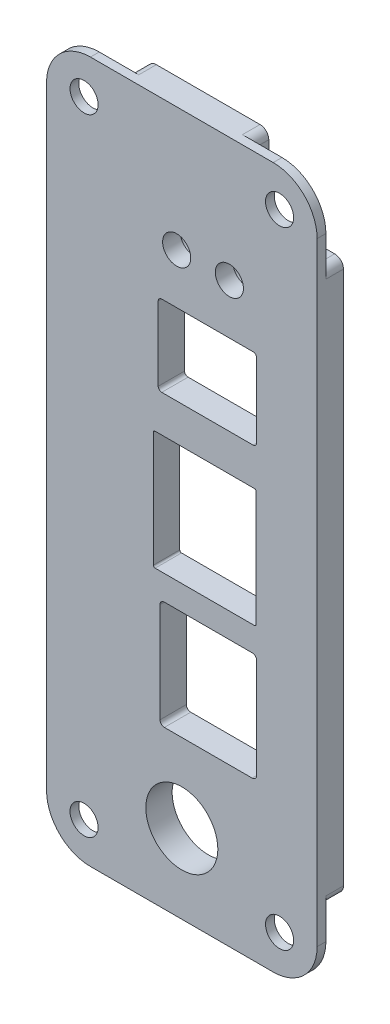
from build123d import *

# Parameters (mm, degrees)
SKETCH_1_R          = 1.6
EXTRUDE_1_DEPTH     = 3
SKETCH_2_W          = 11
SKETCH_2_H          = 38
CUT_EXTRUDE_1_DEPTH = 1
CUT_EXTRUDE_START   = -2
CUT_EXTRUDE_2_DEPTH = 2
SKETCH_4_R          = 1.6
CUT_EXTRUDE_3_DEPTH = 62.990079852
SKETCH_6_R          = 2
CUT_EXTRUDE_4_DEPTH = 1
SKETCH_7_R          = 4.1
CUT_EXTRUDE_5_DEPTH = 63.030395775
FILLET_1_R          = 1


with BuildPart() as part:
    # 草图1 → 凸台-拉伸1 (new body)
    with BuildSketch(Plane.XY):
        with BuildLine():
            Line((47.4, -34.9), (47.4, 34.9))
            ThreePointArc((47.4, 34.9), (45.935533906, 38.435533906), (42.4, 39.9))
            Line((42.4, 39.9), (21.6, 39.9))
            ThreePointArc((21.6, 39.9), (18.064466094, 38.435533906), (16.6, 34.9))
            Line((16.6, 34.9), (16.6, -34.9))
            ThreePointArc((16.6, -34.9), (18.064466094, -38.435533906), (21.6, -39.9))
            Line((21.6, -39.9), (42.4, -39.9))
            ThreePointArc((42.4, -39.9), (45.935533906, -38.435533906), (47.4, -34.9))
        make_face()
        with Locations((37.413843028, 25.79305128)):
            Circle(SKETCH_1_R, mode=Mode.SUBTRACT)
        with Locations((31.413843028, 25.79305128)):
            Circle(SKETCH_1_R, mode=Mode.SUBTRACT)
        with BuildLine():
            Line((40.513850359, -21.477641558), (40.513850359, -10.127641653))
            ThreePointArc((40.513850359, -10.127641653), (40.367403749, -9.774088262), (40.013850359, -9.627641653))
            Line((40.013850359, -9.627641653), (30.013850359, -9.627641653))
            ThreePointArc((30.013850359, -9.627641653), (29.660296968, -9.774088262), (29.513850359, -10.127641653))
            Line((29.513850359, -10.127641653), (29.513850359, -21.477641558))
            ThreePointArc((29.513850359, -21.477641558), (29.660296968, -21.831194949), (30.013850359, -21.977641558))
            Line((30.013850359, -21.977641558), (40.013850359, -21.977641558))
            ThreePointArc((40.013850359, -21.977641558), (40.367403749, -21.831194949), (40.513850359, -21.477641558))
        make_face(mode=Mode.SUBTRACT)
        with BuildLine():
            Line((40.464996896, 6.495389649), (40.464996896, -6.604609867))
            ThreePointArc((40.464996896, -6.604609867), (40.406418252, -6.746031223), (40.264996896, -6.804609867))
            Line((40.264996896, -6.804609867), (28.963873947, -6.804609867))
            ThreePointArc((28.963873947, -6.804609867), (28.822452591, -6.746031223), (28.763873947, -6.604609867))
            Line((28.763873947, -6.604609867), (28.763873947, 6.495389649))
            ThreePointArc((28.763873947, 6.495389649), (28.822452591, 6.636811005), (28.963873947, 6.695389649))
            Line((28.963873947, 6.695389649), (40.264996896, 6.695389649))
            ThreePointArc((40.264996896, 6.695389649), (40.406418252, 6.636811005), (40.464996896, 6.495389649))
        make_face(mode=Mode.SUBTRACT)
        with BuildLine():
            Line((40.513843009, 11.302412116), (40.513843009, 19.702429875))
            ThreePointArc((40.513843009, 19.702429875), (40.396685721, 19.985272588), (40.113843009, 20.102429875))
            Line((40.113843009, 20.102429875), (29.713821303, 20.102429875))
            ThreePointArc((29.713821303, 20.102429875), (29.43097859, 19.985272588), (29.313821303, 19.702429875))
            Line((29.313821303, 19.702429875), (29.313821303, 11.302412116))
            ThreePointArc((29.313821303, 11.302412116), (29.43097859, 11.019569403), (29.713821303, 10.902412116))
            Line((29.713821303, 10.902412116), (40.113843009, 10.902412116))
            ThreePointArc((40.113843009, 10.902412116), (40.396685721, 11.019569403), (40.513843009, 11.302412116))
        make_face(mode=Mode.SUBTRACT)
    extrude(amount=-EXTRUDE_1_DEPTH)

    # 草图2 → 切除-拉伸1 (cut)
    with BuildSketch(Plane(origin=(0, 0, -3), x_dir=(-1, 0, 0), z_dir=(0, 0, -1))):
        with Locations((-22.1, 0)):
            Rectangle(SKETCH_2_W, SKETCH_2_H)
    extrude(amount=-CUT_EXTRUDE_1_DEPTH, mode=Mode.SUBTRACT)

    # 草图3 → 切除-拉伸2 (cut)
    with BuildSketch(Plane(origin=(0, 0, -3), x_dir=(-1, 0, 0), z_dir=(0, 0, -1)).offset(CUT_EXTRUDE_START)):
        with BuildLine():
            Line((-47.4, -31.4), (-38.9, -31.4))
            Line((-38.9, -31.4), (-38.9, -39.9))
            Line((-38.9, -39.9), (-42.4, -39.9))
            ThreePointArc((-42.4, -39.9), (-45.935533906, -38.435533906), (-47.4, -34.9))
            Line((-47.4, -34.9), (-47.4, -31.4))
        make_face()
        with BuildLine():
            Line((-47.4, 34.9), (-47.4, 31.4))
            Line((-47.4, 31.4), (-38.9, 31.4))
            Line((-38.9, 31.4), (-38.9, 39.9))
            Line((-38.9, 39.9), (-42.4, 39.9))
            ThreePointArc((-42.4, 39.9), (-45.935533906, 38.435533906), (-47.4, 34.9))
        make_face()
        with BuildLine():
            Line((-16.6, 31.4), (-25.1, 31.4))
            Line((-25.1, 31.4), (-25.1, 39.9))
            Line((-25.1, 39.9), (-21.6, 39.9))
            ThreePointArc((-21.6, 39.9), (-18.064466094, 38.435533906), (-16.6, 34.9))
            Line((-16.6, 34.9), (-16.6, 31.4))
        make_face()
        with BuildLine():
            Line((-16.6, -34.9), (-16.6, -31.4))
            Line((-16.6, -31.4), (-25.1, -31.4))
            Line((-25.1, -31.4), (-25.1, -39.9))
            Line((-25.1, -39.9), (-21.6, -39.9))
            ThreePointArc((-21.6, -39.9), (-18.064466094, -38.435533906), (-16.6, -34.9))
        make_face()
    extrude(amount=CUT_EXTRUDE_2_DEPTH, mode=Mode.SUBTRACT)

    # 草图4 → 切除-拉伸3 (cut, through all)
    with BuildSketch(Plane(origin=(0, 0, -1), x_dir=(-1, 0, 0), z_dir=(0, 0, -1))):
        with Locations((-20.872307757, 35.627692243)):
            Circle(SKETCH_4_R)
        with Locations(Location((-20.872307757, -35.627692243, 0), (0, 0, 180))):
            Circle(SKETCH_4_R)
        with Locations((-43.127692243, -35.627692243)):
            Circle(SKETCH_4_R)
        with Locations(Location((-43.127692243, 35.627692243, 0), (0, 0, 180))):
            Circle(SKETCH_4_R)
    extrude(amount=-CUT_EXTRUDE_3_DEPTH, mode=Mode.SUBTRACT)

    # 草图6 → 切除-拉伸4 (cut)
    with BuildSketch(Plane(origin=(0, 0, -3), x_dir=(-1, 0, 0), z_dir=(0, 0, -1))):
        with Locations((-37.413843028, 25.79305128)):
            Circle(SKETCH_6_R)
        with Locations((-31.413843028, 25.79305128)):
            Circle(SKETCH_6_R)
    extrude(amount=-CUT_EXTRUDE_4_DEPTH, mode=Mode.SUBTRACT)

    # 草图7 → 切除-拉伸5 (cut, through all)
    with BuildSketch(Plane.XY):
        with Locations((32, -30.938820779)):
            Circle(SKETCH_7_R)
    extrude(amount=-CUT_EXTRUDE_5_DEPTH, mode=Mode.SUBTRACT)

    # 圆角1
    fillet_1_edges = [part.edges().sort_by_distance(p)[0] for p in [
        (25.1, -39.9, -2),
        (16.6, -31.4, -2),
        (16.6, 31.4, -2),
        (25.1, 39.9, -2),
        (38.9, 39.9, -2),
        (47.4, 31.4, -2),
        (47.4, -31.4, -2),
        (38.9, -39.9, -2),
    ]]
    fillet(fillet_1_edges, radius=FILLET_1_R)


solid = part.part
